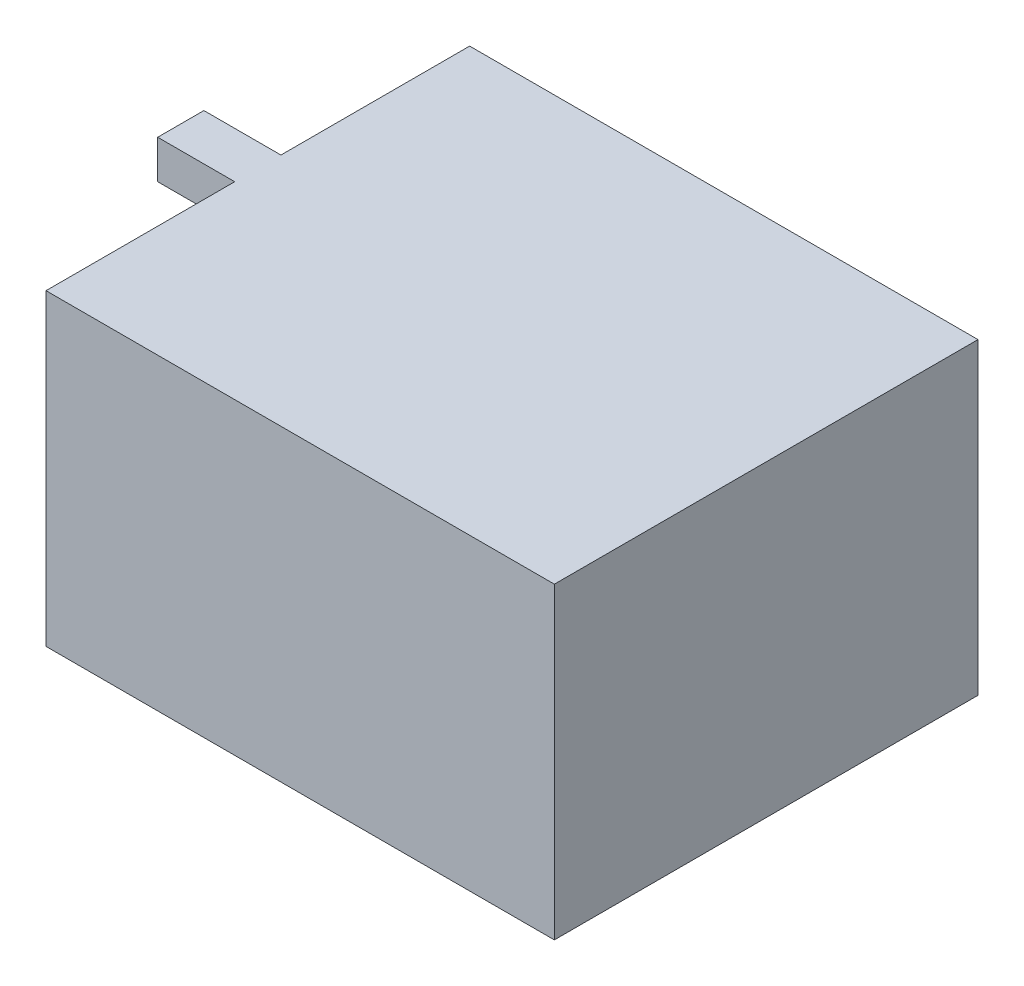
from build123d import *

# Parameters (mm, degrees)
SKETCH_1_W      = 66
SKETCH_1_H      = 55
EXTRUDE_1_DEPTH = 40
SKETCH_2_W      = 6
SKETCH_2_H      = 5
EXTRUDE_2_DEPTH = 10


with BuildPart() as part:
    # 草图1 → 凸台-拉伸1 (new body)
    with BuildSketch(Plane(origin=(0, 0, 0), x_dir=(1, 0, 0), z_dir=(0, 1, 0))):
        Rectangle(SKETCH_1_W, SKETCH_1_H)
    extrude(amount=EXTRUDE_1_DEPTH)

    # 草图2 → 凸台-拉伸2 (add)
    with BuildSketch(Plane.ZY.offset(33)):
        with Locations((0, 37.5)):
            Rectangle(SKETCH_2_W, SKETCH_2_H)
    extrude(amount=EXTRUDE_2_DEPTH)


solid = part.part
